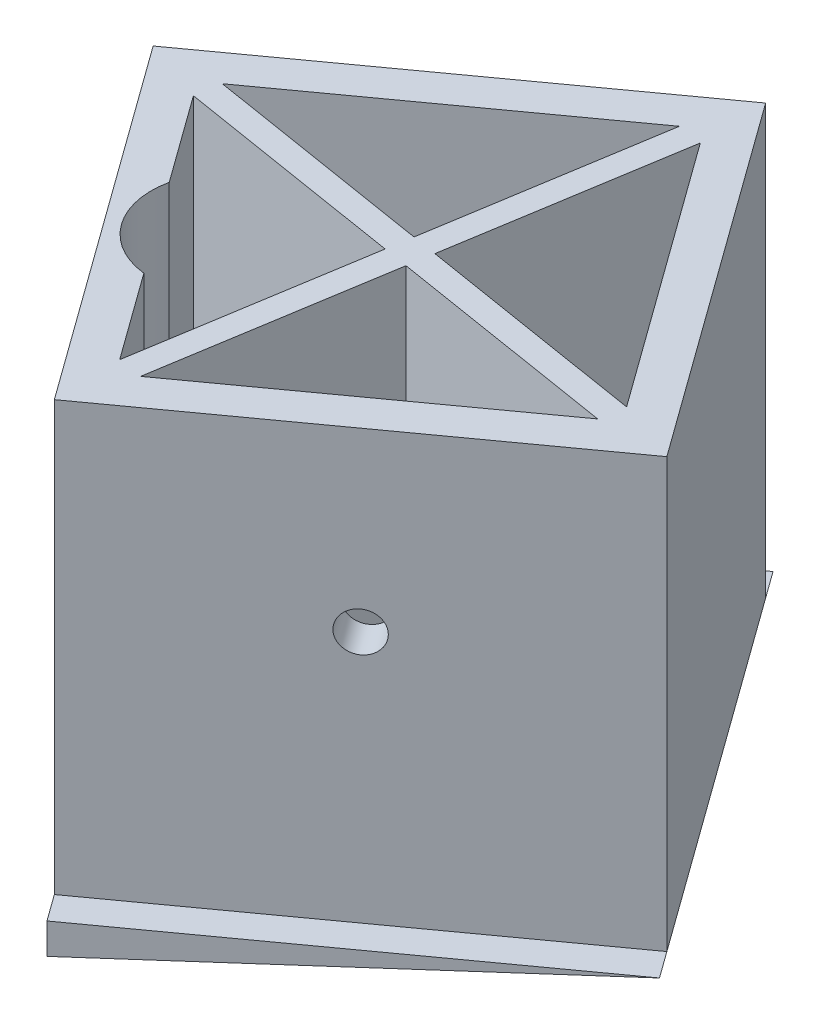
from build123d import *
from build123d.topology import SkipClean

# Parameters (mm, degrees)
SKETCH1_R           = 1.5
BOSS_EXTRUDE2_DEPTH = 2.54
BOSS_EXTRUDE3_DEPTH = 19.05
BOSS_EXTRUDE6_DEPTH = 19.05
SKETCH4_R           = 1
CUT_EXTRUDE1_DEPTH  = 158.597711186
FILLET1_R           = 6.35
BOSS_EXTRUDE7_DEPTH = 12.7
SKETCH6_R           = 1.5
CUT_EXTRUDE2_DEPTH  = 159.693396714


with BuildPart() as part:
    # Sketch1 → Boss-Extrude2 (new body)
    with BuildSketch(Plane(origin=(0, 0, 0), x_dir=(1, 0, 0), z_dir=(0, 1, 0))):
        Polygon((-93.521103592, -81.172331094), (-106.459273851, -63.257941504), (-124.37366344, -76.196111763), (-111.435493182, -94.110501353), align=None)
        with Locations(Location((-114.3, -82.55, 0), (0, 0, 270))):
            Circle(SKETCH1_R, mode=Mode.SUBTRACT)
    extrude(amount=BOSS_EXTRUDE2_DEPTH)

    # Sketch2 → Boss-Extrude3 (add)
    with BuildSketch(Plane(origin=(0, 2.54, 0), x_dir=(1, 0, 0), z_dir=(0, 1, 0))):
        Polygon((-106.459273851, -63.257941504), (-124.37366344, -76.196111763), (-111.435493182, -94.110501353), (-93.521103592, -81.172331094), align=None)
        with BuildLine():
            Line((-106.888258276, -65.91764494), (-121.713960005, -76.625096188))
            Line((-121.713960005, -76.625096188), (-118.022197338, -81.736767574))
            ThreePointArc((-118.022197338, -81.736767574), (-117.38868786, -84.78071901), (-114.698271424, -86.339126532))
            Line((-114.698271424, -86.339126532), (-111.006508757, -91.450797917))
            Line((-111.006508757, -91.450797917), (-96.180807028, -80.743346669))
            Line((-96.180807028, -80.743346669), (-106.888258276, -65.91764494))
        make_face(mode=Mode.SUBTRACT)
    extrude(amount=BOSS_EXTRUDE3_DEPTH)

    # Sketch3 → Boss-Extrude6 (add)
    with BuildSketch(Plane(origin=(0, 21.59, 0), x_dir=(1, 0, 0), z_dir=(0, 1, 0))):
        Polygon((-121.713960005, -76.625096188), (-121.188174492, -77.353106899), (-109.675394227, -79.210006941), (-111.53229427, -90.722787207), (-111.006508757, -91.450797917), (-110.278498046, -90.925012404), (-108.421598003, -79.412232139), (-96.908817738, -81.269132182), (-96.180807028, -80.743346669), (-96.706592541, -80.015335958), (-108.219372806, -78.158435915), (-106.362472763, -66.64565565), (-106.888258276, -65.91764494), (-107.616268987, -66.443430453), (-109.473169029, -77.956210718), (-120.985949295, -76.099310675), align=None)
    extrude(amount=-BOSS_EXTRUDE6_DEPTH)

    # Sketch4 → Cut-Extrude1 (cut, through all)
    with BuildSketch(Plane(origin=(6.469085129, 0, 8.957194795), x_dir=(0.8106792283998809, 0, -0.5854905538443587), z_dir=(0.5854905538443586, 0, 0.8106792283998808))):
        with Locations(Location((-134.390249188, 12.7, 0), (0, 0, 90))):
            Circle(SKETCH4_R)
    extrude(amount=-CUT_EXTRUDE1_DEPTH, mode=Mode.SUBTRACT)

    # Fillet1
    fillet1_edges = [part.edges().sort_by_distance(p)[0] for p in [
        (-103.593657892, 2.54, 86.097072293),
        (-114.301109141, 2.54, 71.271370564),
    ]]
    fillet(fillet1_edges, radius=FILLET1_R)

    # Sketch5 → Boss-Extrude7 (add, symmetric)
    with BuildSketch(Plane(origin=(0, 0, 0), x_dir=(-0.8106792283998807, 0, 0.585490553844359), z_dir=(-0.5854905538443589, 0, -0.8106792283998806))):
        Polygon((123.341249188, 0), (145.439249188, 0), (145.439249188, -1.54524269), align=None)
    extrude(amount=BOSS_EXTRUDE7_DEPTH, both=True)

    # Sketch6 → Cut-Extrude2 (cut, through all)
    with SkipClean():  # the faces are left unmerged after this step: merging them gives an invalid solid
        with BuildSketch(Plane(origin=(0, 2.54, 0), x_dir=(1, 0, 0), z_dir=(0, 1, 0))):
            with Locations(Location((-114.3, -82.55, 0), (0, 0, 35.837652954))):
                Circle(SKETCH6_R)
        extrude(amount=-CUT_EXTRUDE2_DEPTH, mode=Mode.SUBTRACT)


solid = part.part
